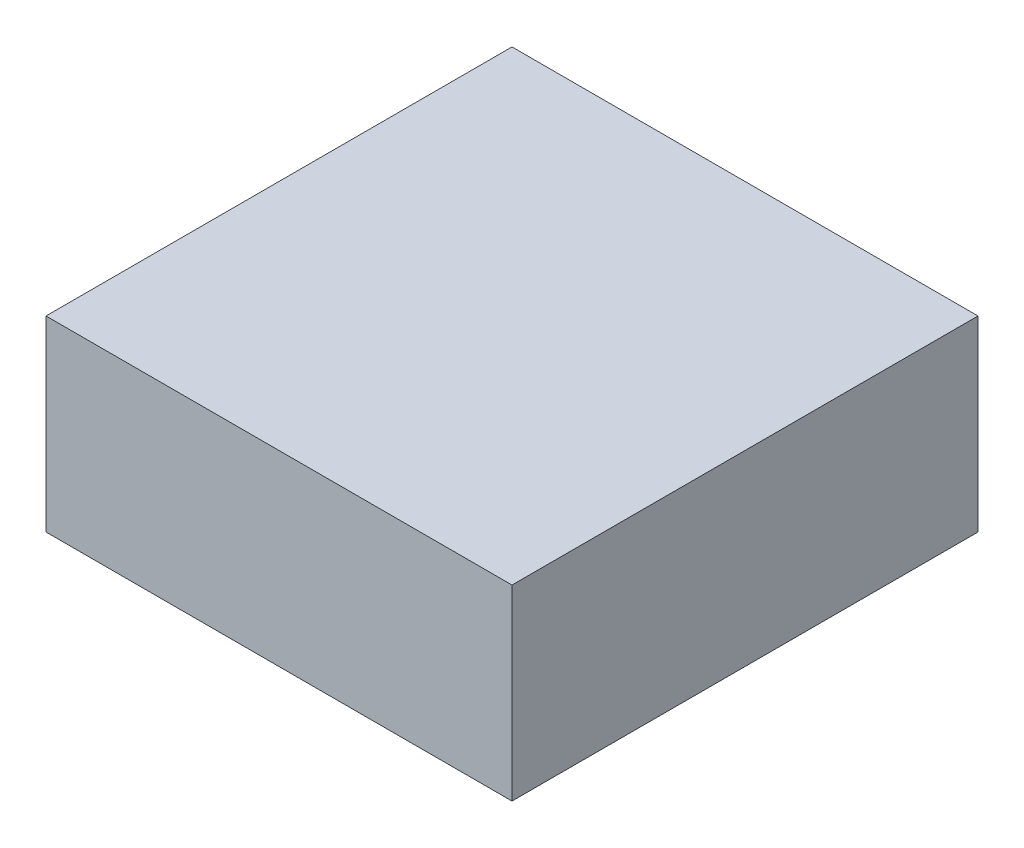
from build123d import *

# Parameters (mm, degrees)
SKETCH2_W           = 7.82
SKETCH2_H           = 7.82
BOSS_EXTRUDE1_DEPTH = 3.14
SHELL1_T            = -1.5


with BuildPart() as part:
    # Sketch2 → Boss-Extrude1 (new body)
    with BuildSketch(Plane(origin=(0, 0, 0), x_dir=(1, 0, 0), z_dir=(0, 1, 0))):
        Rectangle(SKETCH2_W, SKETCH2_H)
    extrude(amount=-BOSS_EXTRUDE1_DEPTH)

    # Shell1
    shell1_openings = [part.faces().sort_by_distance(p)[0] for p in [
        (0, -3.14, 0),
    ]]
    offset(amount=SHELL1_T, openings=shell1_openings, kind=Kind.INTERSECTION)


solid = part.part
